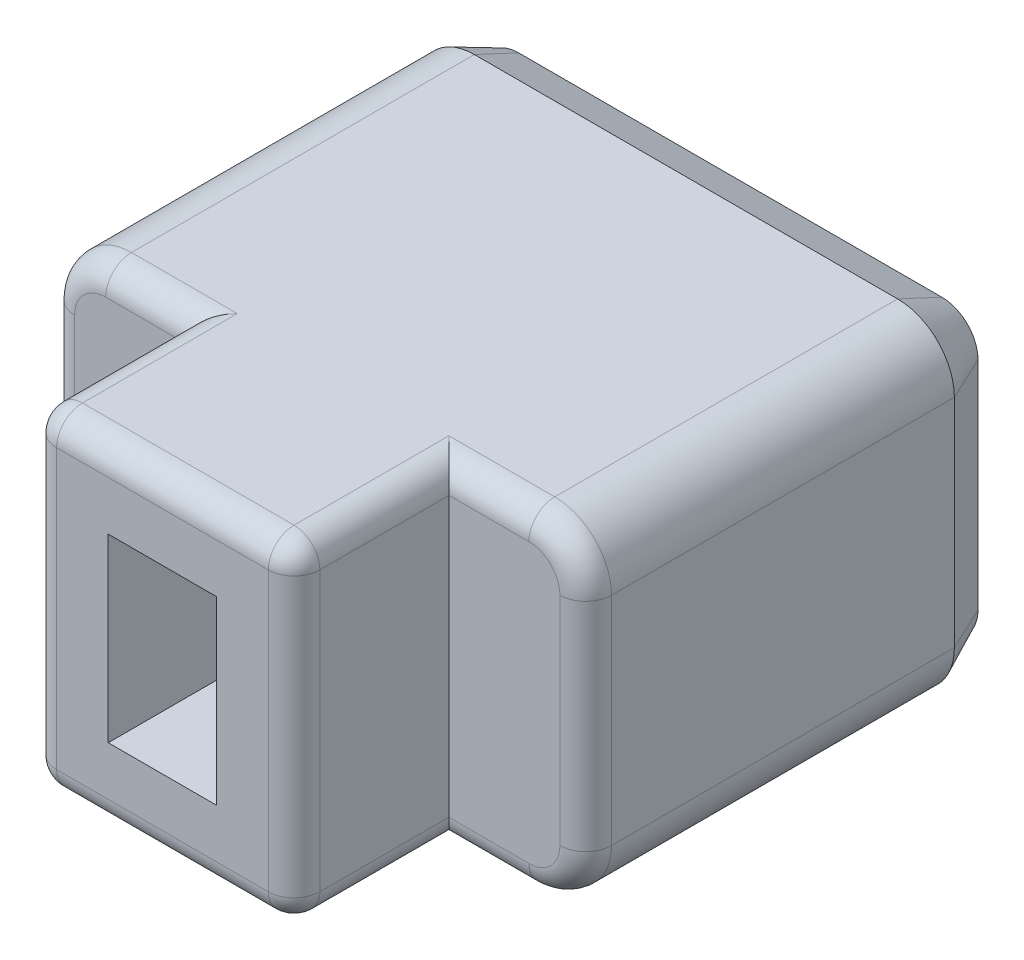
from build123d import *

# Parameters (mm, degrees)
BOSS_EXTRU_1_DEPTH      = 11
ESQUISSE3_W             = 2.1
ESQUISSE3_H             = 3.5
ENL_V_MAT_EXTRU_1_DEPTH = 3
ESQUISSE4_OUTSIDE_W     = 15.688
ESQUISSE4_OUTSIDE_H     = 11.688
ESQUISSE4_OUTSIDE_W_2   = 5.1
ESQUISSE4_OUTSIDE_H_2   = 6.4
ENL_V_MAT_EXTRU_2_DEPTH = 3
CONG_1_R                = 0.5
CHANFREIN1_SIZE         = 0.4
CHANFREIN1_SIZE2        = 0.857802768
ESQUISSE5_W             = 0.367948718
ESQUISSE5_H             = 4.1
ENL_V_MAT_EXTRU_3_DEPTH = 0.3
ESQUISSE5_2_W           = 0.367948718
ESQUISSE5_2_H           = 4.1
BOSS_EXTRU_2_DEPTH      = 0.3
BOSS_EXTRU_2_2_DEPTH    = 0.3
BOSS_EXTRU_2_3_DEPTH    = 0.3


with BuildPart() as part:
    # Esquisse2 → Boss.-Extru.1 (new body)
    with BuildSketch(Plane.XY):
        with BuildLine():
            Line((1.1, 0), (9.3, 0))
            ThreePointArc((9.3, 0), (10.077817459, 0.322182541), (10.4, 1.1))
            Line((10.4, 1.1), (10.4, 5.3))
            ThreePointArc((10.4, 5.3), (10.077817459, 6.077817459), (9.3, 6.4))
            Line((9.3, 6.4), (1.1, 6.4))
            ThreePointArc((1.1, 6.4), (0.322182541, 6.077817459), (0, 5.3))
            Line((0, 5.3), (0, 1.1))
            ThreePointArc((0, 1.1), (0.322182541, 0.322182541), (1.1, 0))
        make_face()
    extrude(amount=BOSS_EXTRU_1_DEPTH)

    # Esquisse3 → Enlèv. mat.-Extru.1 (cut)
    with BuildSketch(Plane.XY.offset(11)):
        with Locations((5.2, 3.2)):
            Rectangle(ESQUISSE3_W, ESQUISSE3_H)
    extrude(amount=-ENL_V_MAT_EXTRU_1_DEPTH, mode=Mode.SUBTRACT)

    # Esquisse4 outside → Enlèv. mat.-Extru.2 (cut)
    with BuildSketch(Plane.XY.offset(11)):
        with Locations((5.2, 3.2)):
            Rectangle(ESQUISSE4_OUTSIDE_W, ESQUISSE4_OUTSIDE_H)
        with Locations((5.2, 3.2)):
            Rectangle(ESQUISSE4_OUTSIDE_W_2, ESQUISSE4_OUTSIDE_H_2, mode=Mode.SUBTRACT)
    extrude(amount=-ENL_V_MAT_EXTRU_2_DEPTH, mode=Mode.SUBTRACT)

    # Congé1
    cong_1_edges = [part.edges().sort_by_distance(p)[0] for p in [
        (8.525, 0, 8),
        (10.077817459, 0.322182541, 8),
        (10.4, 3.2, 8),
        (10.077817459, 6.077817459, 8),
        (1.875, 6.4, 8),
        (0.322182541, 6.077817459, 8),
        (1.875, 0, 8),
        (0.322182541, 0.322182541, 8),
        (7.75, 6.4, 9.5),
        (2.65, 6.4, 9.5),
        (7.75, 0, 9.5),
        (2.65, 0, 9.5),
        (2.65, 3.2, 11),
        (5.2, 6.4, 11),
        (7.75, 3.2, 11),
        (5.2, 0, 11),
        (8.525, 6.4, 8),
        (0, 3.2, 8),
    ]]
    fillet(cong_1_edges, radius=CONG_1_R)

    # Chanfrein1
    chanfrein1_edges = [part.edges().sort_by_distance(p)[0] for p in [
        (5.2, 0, 0),
        (10.077817459, 0.322182541, 0),
        (0.322182541, 0.322182541, 0),
        (10.4, 3.2, 0),
        (0, 3.2, 0),
        (10.077817459, 6.077817459, 0),
        (0.322182541, 6.077817459, 0),
        (5.2, 6.4, 0),
    ]]
    chanfrein1_side = [part.faces().sort_by_distance(p)[0] for p in [
        (5.2, 3.2, 0),
    ]]
    chamfer(chanfrein1_edges, length=CHANFREIN1_SIZE, length2=CHANFREIN1_SIZE2, reference=chanfrein1_side[0])

    # Esquisse5 → Enlèv. mat.-Extru.3 (cut)
    # profile 1 of 3: a face of its own
    with BuildSketch(Plane(origin=(0, 0, 0), x_dir=(-1, 0, 0), z_dir=(0, 0, -1))):
        with Locations((-1.941025641, 3.25)):
            Rectangle(ESQUISSE5_W, ESQUISSE5_H)
    # profile 2 of 3: a face of its own
    with BuildSketch(Plane(origin=(0, 0, 0), x_dir=(-1, 0, 0), z_dir=(0, 0, -1))):
        with BuildLine():
            Line((-3.018589744, 5.3), (-3.018589744, 1.2))
            Line((-3.018589744, 1.2), (-3.846474359, 1.2))
            add(Edge.make_bspline(
                [(-3.846474359, 1.2), (-3.918481038, 1.200517026), (-4.057597566, 1.201515919), (-4.258627285, 1.207885614), (-4.444365827, 1.219039841), (-4.614707713, 1.235600692), (-4.76992661, 1.255478355), (-4.909773919, 1.280757779), (-5.034476271, 1.310488093), (-5.111168895, 1.335845385), (-5.147435897, 1.347836538)],
                knots=[0, 0, 0, 0, 1.314317071, 2.539253741, 3.67075822, 4.709970291, 5.662644612, 6.526156501, 7.303037452, 8, 8, 8, 8], degree=3))
            add(Edge.make_bspline(
                [(-5.147435897, 1.347836538), (-5.194876834, 1.365906899), (-5.288682905, 1.401637845), (-5.422172522, 1.469142364), (-5.548264277, 1.545315195), (-5.665962542, 1.631902715), (-5.775526661, 1.727798439), (-5.878335188, 1.832226494), (-5.971441307, 1.947974756), (-6.058056276, 2.071451599), (-6.133866846, 2.203780688), (-6.200717201, 2.34231149), (-6.257797254, 2.486775214), (-6.302335028, 2.638225945), (-6.339130926, 2.795209059), (-6.363820071, 2.958913108), (-6.380220077, 3.128383688), (-6.381860147, 3.243389539), (-6.382692308, 3.301742788)],
                knots=[0, 0, 0, 0, 0.984696416, 1.947063185, 2.89840987, 3.841051395, 4.778753227, 5.721858861, 6.681155121, 7.65838316, 8.646299769, 9.637283673, 10.641736726, 11.657050558, 12.698485921, 13.768600492, 14.86780186, 16, 16, 16, 16], degree=3))
            add(Edge.make_bspline(
                [(-6.382692308, 3.301742788), (-6.38195502, 3.352420067), (-6.380502118, 3.452284939), (-6.367472035, 3.599466733), (-6.348496631, 3.742270786), (-6.319253431, 3.880070059), (-6.283320065, 4.013792315), (-6.23896913, 4.142804399), (-6.18640201, 4.267193997), (-6.125439081, 4.385973114), (-6.058687162, 4.498852926), (-5.985949986, 4.604044923), (-5.909718031, 4.702708892), (-5.827210978, 4.792615906), (-5.741160551, 4.876565695), (-5.648640057, 4.950834238), (-5.55254642, 5.018869439), (-5.44999271, 5.078605183), (-5.340137512, 5.131741903), (-5.220111251, 5.176616182), (-5.09035199, 5.215233842), (-4.949999918, 5.246001751), (-4.799523123, 5.270802246), (-4.638513695, 5.287318103), (-4.467273135, 5.298517915), (-4.34968561, 5.299496379), (-4.28916266, 5.3)],
                knots=[0, 0, 0, 0, 1.105894396, 2.179280415, 3.222964075, 4.248423888, 5.251546139, 6.243661943, 7.223682738, 8.196462441, 9.155694589, 10.083899862, 10.986397372, 11.874737962, 12.745335529, 13.607670254, 14.461432187, 15.313100333, 16.195087267, 17.121790994, 18.106827133, 19.14775296, 20.255889161, 21.433815148, 22.679170477, 24, 24, 24, 24], degree=3))
            Line((-4.28916266, 5.3), (-3.018589744, 5.3))
        make_face()
        with BuildLine():
            Line((-3.386538462, 4.879487179), (-3.857151442, 4.879487179))
            add(Edge.make_bspline(
                [(-3.857151442, 4.879487179), (-3.924776105, 4.879196552), (-4.054843098, 4.87863757), (-4.241871037, 4.87373256), (-4.41275833, 4.865717719), (-4.567529241, 4.8545012), (-4.706096384, 4.839660822), (-4.828749348, 4.823114507), (-4.935086079, 4.802500351), (-4.999431991, 4.783814941), (-5.029166667, 4.775180288)],
                knots=[0, 0, 0, 0, 1.375205317, 2.645023457, 3.804390687, 4.853969522, 5.800190428, 6.637939096, 7.370582563, 8, 8, 8, 8], degree=3))
            add(Edge.make_bspline(
                [(-5.029166667, 4.775180288), (-5.066592686, 4.762000876), (-5.140550805, 4.735956842), (-5.247000006, 4.6884322), (-5.346329209, 4.632206883), (-5.440194337, 4.569339124), (-5.52799215, 4.498858185), (-5.609316063, 4.42053992), (-5.684808433, 4.335291035), (-5.753260557, 4.242824282), (-5.815170072, 4.144165625), (-5.86865969, 4.039424964), (-5.913750832, 3.929190063), (-5.950745116, 3.81384445), (-5.979587972, 3.693319475), (-5.999894478, 3.56731268), (-6.012478182, 3.435873827), (-6.01398022, 3.346396066), (-6.01474359, 3.300921474)],
                knots=[0, 0, 0, 0, 0.998420628, 1.972994, 2.929372424, 3.86770908, 4.81360496, 5.759023883, 6.706048443, 7.676227424, 8.651287839, 9.634325482, 10.632389399, 11.645655052, 12.680158286, 13.74837235, 14.855672678, 16, 16, 16, 16], degree=3))
            add(Edge.make_bspline(
                [(-6.01474359, 3.300921474), (-6.014141669, 3.252971113), (-6.012959192, 3.158772204), (-5.998121227, 3.020550462), (-5.976391629, 2.887630733), (-5.945135298, 2.75991732), (-5.904754812, 2.637576382), (-5.856436288, 2.519916744), (-5.797770016, 2.408452573), (-5.731353593, 2.302239812), (-5.656788995, 2.202886984), (-5.574406987, 2.111558061), (-5.485076237, 2.02808292), (-5.389208443, 1.952328654), (-5.285463211, 1.885642449), (-5.175596116, 1.826319442), (-5.058059531, 1.775915087), (-4.976277405, 1.7491161), (-4.934715545, 1.735496795)],
                knots=[0, 0, 0, 0, 1.122272916, 2.204715076, 3.251197285, 4.274229216, 5.279697671, 6.265416158, 7.248880903, 8.225321784, 9.195852973, 10.153576302, 11.101466393, 12.055578741, 13.010401466, 13.985536859, 14.976245305, 16, 16, 16, 16], degree=3))
            add(Edge.make_bspline(
                [(-4.934715545, 1.735496795), (-4.900332773, 1.725988979), (-4.827225568, 1.705772755), (-4.70792791, 1.683720176), (-4.573664449, 1.664269191), (-4.423839085, 1.647801202), (-4.258622604, 1.635984626), (-4.077887941, 1.627115371), (-3.881556976, 1.621133316), (-3.745457436, 1.620724831), (-3.674819712, 1.620512821)],
                knots=[0, 0, 0, 0, 0.674548936, 1.434276114, 2.292660221, 3.240891867, 4.284742987, 5.42552168, 6.663806718, 8, 8, 8, 8], degree=3))
            Line((-3.674819712, 1.620512821), (-3.386538462, 1.620512821))
            Line((-3.386538462, 1.620512821), (-3.386538462, 4.879487179))
        make_face(mode=Mode.SUBTRACT)
    # profile 3 of 3: a face of its own
    with BuildSketch(Plane(origin=(0, 0, 0), x_dir=(-1, 0, 0), z_dir=(0, 0, -1))):
        Polygon((-6.750641026, 1.620512821), (-6.750641026, 1.2), (-8.905769231, 1.2), (-8.905769231, 1.620512821), (-8.012179487, 1.620512821), (-8.012179487, 5.3), (-7.644230769, 5.3), (-7.644230769, 1.620512821), align=None)
    extrude(amount=-ENL_V_MAT_EXTRU_3_DEPTH, mode=Mode.SUBTRACT)


with BuildPart() as body_2:
    # Esquisse5<2> → Boss.-Extru.2 (new body)
    with BuildSketch(Plane(origin=(0, 0, 0), x_dir=(-1, 0, 0), z_dir=(0, 0, -1))):
        with Locations((-1.941025641, 3.25)):
            Rectangle(ESQUISSE5_2_W, ESQUISSE5_2_H)
    extrude(amount=BOSS_EXTRU_2_DEPTH)


with BuildPart() as body_3:
    # Esquisse5<2> → Boss.-Extru.2 2 (new body)
    with BuildSketch(Plane(origin=(0, 0, 0), x_dir=(-1, 0, 0), z_dir=(0, 0, -1))):
        with BuildLine():
            Line((-3.018589744, 5.3), (-3.018589744, 1.2))
            Line((-3.018589744, 1.2), (-3.846474359, 1.2))
            add(Edge.make_bspline(
                [(-3.846474359, 1.2), (-3.918481038, 1.200517026), (-4.057597566, 1.201515919), (-4.258627285, 1.207885614), (-4.444365827, 1.219039841), (-4.614707713, 1.235600692), (-4.76992661, 1.255478355), (-4.909773919, 1.280757779), (-5.034476271, 1.310488093), (-5.111168895, 1.335845385), (-5.147435897, 1.347836538)],
                knots=[0, 0, 0, 0, 1.314317071, 2.539253741, 3.67075822, 4.709970291, 5.662644612, 6.526156501, 7.303037452, 8, 8, 8, 8], degree=3))
            add(Edge.make_bspline(
                [(-5.147435897, 1.347836538), (-5.194876834, 1.365906899), (-5.288682905, 1.401637845), (-5.422172522, 1.469142364), (-5.548264277, 1.545315195), (-5.665962542, 1.631902715), (-5.775526661, 1.727798439), (-5.878335188, 1.832226494), (-5.971441307, 1.947974756), (-6.058056276, 2.071451599), (-6.133866846, 2.203780688), (-6.200717201, 2.34231149), (-6.257797254, 2.486775214), (-6.302335028, 2.638225945), (-6.339130926, 2.795209059), (-6.363820071, 2.958913108), (-6.380220077, 3.128383688), (-6.381860147, 3.243389539), (-6.382692308, 3.301742788)],
                knots=[0, 0, 0, 0, 0.984696416, 1.947063185, 2.89840987, 3.841051395, 4.778753227, 5.721858861, 6.681155121, 7.65838316, 8.646299769, 9.637283673, 10.641736726, 11.657050558, 12.698485921, 13.768600492, 14.86780186, 16, 16, 16, 16], degree=3))
            add(Edge.make_bspline(
                [(-6.382692308, 3.301742788), (-6.38195502, 3.352420067), (-6.380502118, 3.452284939), (-6.367472035, 3.599466733), (-6.348496631, 3.742270786), (-6.319253431, 3.880070059), (-6.283320065, 4.013792315), (-6.23896913, 4.142804399), (-6.18640201, 4.267193997), (-6.125439081, 4.385973114), (-6.058687162, 4.498852926), (-5.985949986, 4.604044923), (-5.909718031, 4.702708892), (-5.827210978, 4.792615906), (-5.741160551, 4.876565695), (-5.648640057, 4.950834238), (-5.55254642, 5.018869439), (-5.44999271, 5.078605183), (-5.340137512, 5.131741903), (-5.220111251, 5.176616182), (-5.09035199, 5.215233842), (-4.949999918, 5.246001751), (-4.799523123, 5.270802246), (-4.638513695, 5.287318103), (-4.467273135, 5.298517915), (-4.34968561, 5.299496379), (-4.28916266, 5.3)],
                knots=[0, 0, 0, 0, 1.105894396, 2.179280415, 3.222964075, 4.248423888, 5.251546139, 6.243661943, 7.223682738, 8.196462441, 9.155694589, 10.083899862, 10.986397372, 11.874737962, 12.745335529, 13.607670254, 14.461432187, 15.313100333, 16.195087267, 17.121790994, 18.106827133, 19.14775296, 20.255889161, 21.433815148, 22.679170477, 24, 24, 24, 24], degree=3))
            Line((-4.28916266, 5.3), (-3.018589744, 5.3))
        make_face()
        with BuildLine():
            Line((-3.386538462, 4.879487179), (-3.857151442, 4.879487179))
            add(Edge.make_bspline(
                [(-3.857151442, 4.879487179), (-3.924776105, 4.879196552), (-4.054843098, 4.87863757), (-4.241871037, 4.87373256), (-4.41275833, 4.865717719), (-4.567529241, 4.8545012), (-4.706096384, 4.839660822), (-4.828749348, 4.823114507), (-4.935086079, 4.802500351), (-4.999431991, 4.783814941), (-5.029166667, 4.775180288)],
                knots=[0, 0, 0, 0, 1.375205317, 2.645023457, 3.804390687, 4.853969522, 5.800190428, 6.637939096, 7.370582563, 8, 8, 8, 8], degree=3))
            add(Edge.make_bspline(
                [(-5.029166667, 4.775180288), (-5.066592686, 4.762000876), (-5.140550805, 4.735956842), (-5.247000006, 4.6884322), (-5.346329209, 4.632206883), (-5.440194337, 4.569339124), (-5.52799215, 4.498858185), (-5.609316063, 4.42053992), (-5.684808433, 4.335291035), (-5.753260557, 4.242824282), (-5.815170072, 4.144165625), (-5.86865969, 4.039424964), (-5.913750832, 3.929190063), (-5.950745116, 3.81384445), (-5.979587972, 3.693319475), (-5.999894478, 3.56731268), (-6.012478182, 3.435873827), (-6.01398022, 3.346396066), (-6.01474359, 3.300921474)],
                knots=[0, 0, 0, 0, 0.998420628, 1.972994, 2.929372424, 3.86770908, 4.81360496, 5.759023883, 6.706048443, 7.676227424, 8.651287839, 9.634325482, 10.632389399, 11.645655052, 12.680158286, 13.74837235, 14.855672678, 16, 16, 16, 16], degree=3))
            add(Edge.make_bspline(
                [(-6.01474359, 3.300921474), (-6.014141669, 3.252971113), (-6.012959192, 3.158772204), (-5.998121227, 3.020550462), (-5.976391629, 2.887630733), (-5.945135298, 2.75991732), (-5.904754812, 2.637576382), (-5.856436288, 2.519916744), (-5.797770016, 2.408452573), (-5.731353593, 2.302239812), (-5.656788995, 2.202886984), (-5.574406987, 2.111558061), (-5.485076237, 2.02808292), (-5.389208443, 1.952328654), (-5.285463211, 1.885642449), (-5.175596116, 1.826319442), (-5.058059531, 1.775915087), (-4.976277405, 1.7491161), (-4.934715545, 1.735496795)],
                knots=[0, 0, 0, 0, 1.122272916, 2.204715076, 3.251197285, 4.274229216, 5.279697671, 6.265416158, 7.248880903, 8.225321784, 9.195852973, 10.153576302, 11.101466393, 12.055578741, 13.010401466, 13.985536859, 14.976245305, 16, 16, 16, 16], degree=3))
            add(Edge.make_bspline(
                [(-4.934715545, 1.735496795), (-4.900332773, 1.725988979), (-4.827225568, 1.705772755), (-4.70792791, 1.683720176), (-4.573664449, 1.664269191), (-4.423839085, 1.647801202), (-4.258622604, 1.635984626), (-4.077887941, 1.627115371), (-3.881556976, 1.621133316), (-3.745457436, 1.620724831), (-3.674819712, 1.620512821)],
                knots=[0, 0, 0, 0, 0.674548936, 1.434276114, 2.292660221, 3.240891867, 4.284742987, 5.42552168, 6.663806718, 8, 8, 8, 8], degree=3))
            Line((-3.674819712, 1.620512821), (-3.386538462, 1.620512821))
            Line((-3.386538462, 1.620512821), (-3.386538462, 4.879487179))
        make_face(mode=Mode.SUBTRACT)
    extrude(amount=BOSS_EXTRU_2_2_DEPTH)


with BuildPart() as body_4:
    # Esquisse5<2> → Boss.-Extru.2 3 (new body)
    with BuildSketch(Plane(origin=(0, 0, 0), x_dir=(-1, 0, 0), z_dir=(0, 0, -1))):
        Polygon((-6.750641026, 1.620512821), (-6.750641026, 1.2), (-8.905769231, 1.2), (-8.905769231, 1.620512821), (-8.012179487, 1.620512821), (-8.012179487, 5.3), (-7.644230769, 5.3), (-7.644230769, 1.620512821), align=None)
    extrude(amount=BOSS_EXTRU_2_3_DEPTH)


solid = Compound([part.part, body_2.part, body_3.part, body_4.part])
